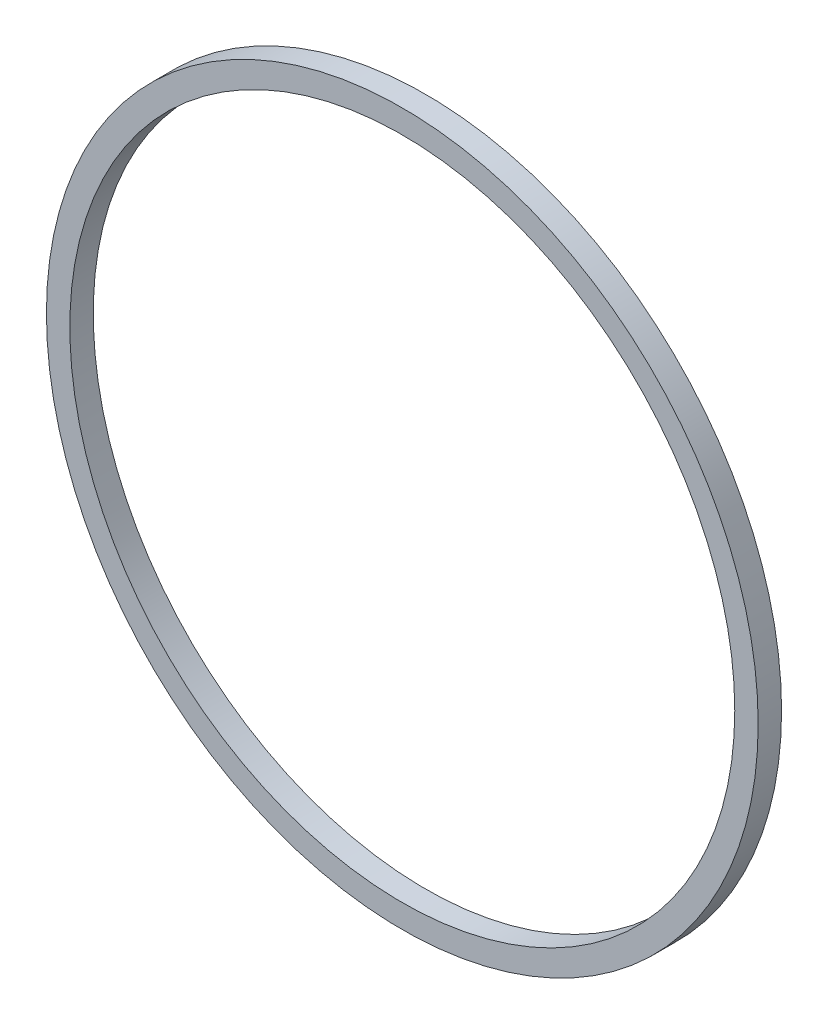
from build123d import *

# Parameters (mm, degrees)
SKETCH2_W = 1.778
SKETCH2_H = 1.778


with BuildPart() as part:
    # Sketch2 → Revolve1 (revolve)
    with BuildSketch(Plane(origin=(0, 0, 0), x_dir=(1, 0, 0), z_dir=(0, 1, 0)), mode=Mode.PRIVATE) as revolve1_sk:
        with Locations((-26.1493, 0)):
            Rectangle(SKETCH2_W, SKETCH2_H)
    revolve(revolve1_sk.sketch.rotate(Axis((0, 0, 0.889), (0, 0, -1)), 180), axis=Axis((0, 0, 0.889), (0, 0, -1)))


solid = part.part
